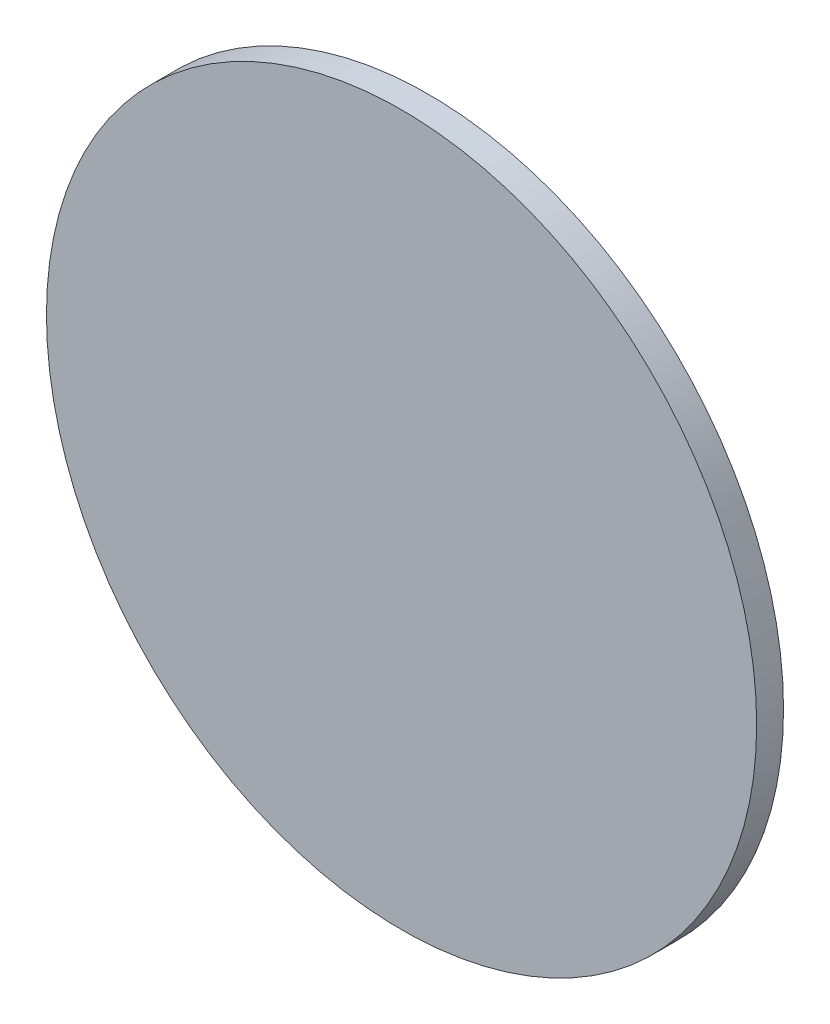
from build123d import *

# Parameters (mm, degrees)
SKETCH1_R                 = 33.562636189
TEST_FEATURE_NAMING_DEPTH = 2.54


with BuildPart() as part:
    # Sketch1 → test feature naming (new body)
    with BuildSketch(Plane.XY):
        with Locations((-13.229737185, 0)):
            Circle(SKETCH1_R)
    extrude(amount=TEST_FEATURE_NAMING_DEPTH)


solid = part.part
